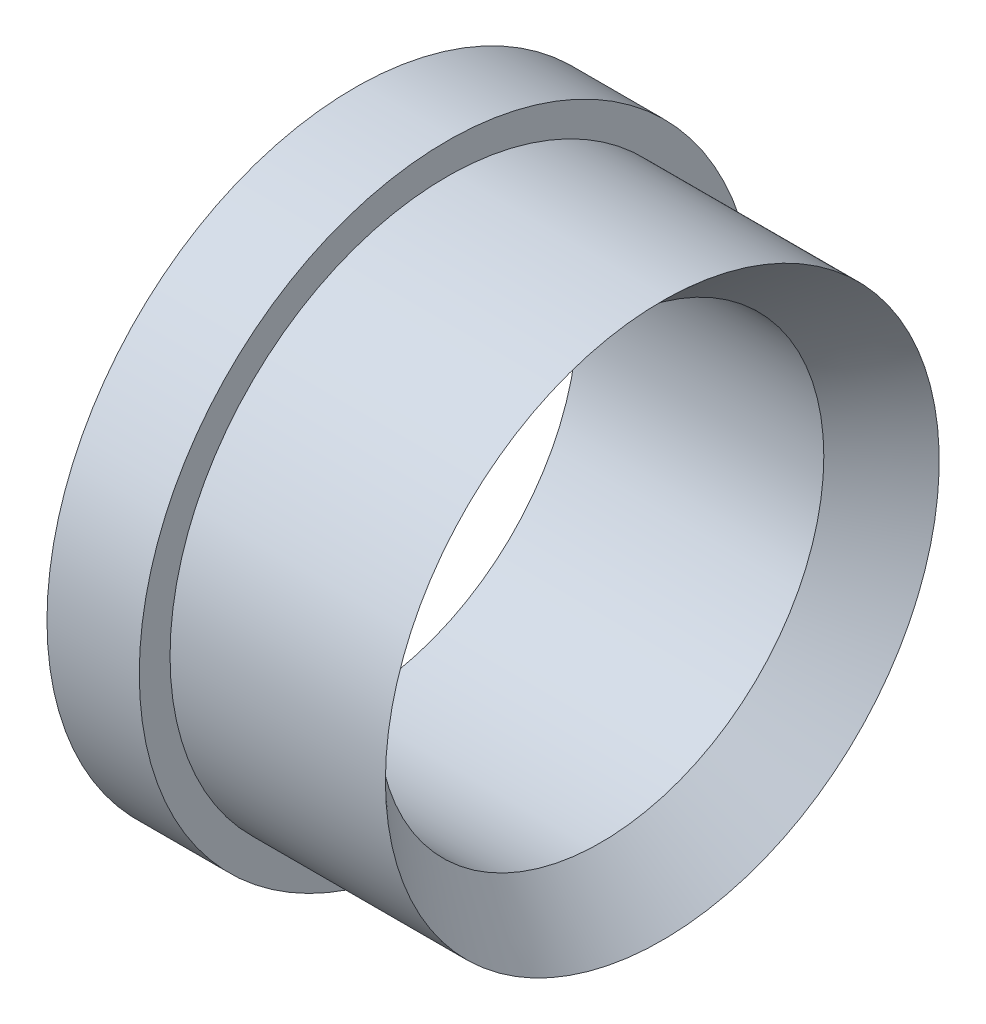
from build123d import *


with BuildPart() as part:
    # Эскиз1 → Повернуть1 (revolve)
    with BuildSketch(Plane.XY, mode=Mode.PRIVATE) as revolve_1_sk:
        Polygon((0, 7.25), (8, 7.25), (10, 9), (3, 9), (3, 10), (0, 10), align=None)
    revolve(revolve_1_sk.sketch.rotate(Axis((0, 0, 0), (1, 0, 0)), 90), axis=Axis((0, 0, 0), (1, 0, 0)))


solid = part.part
